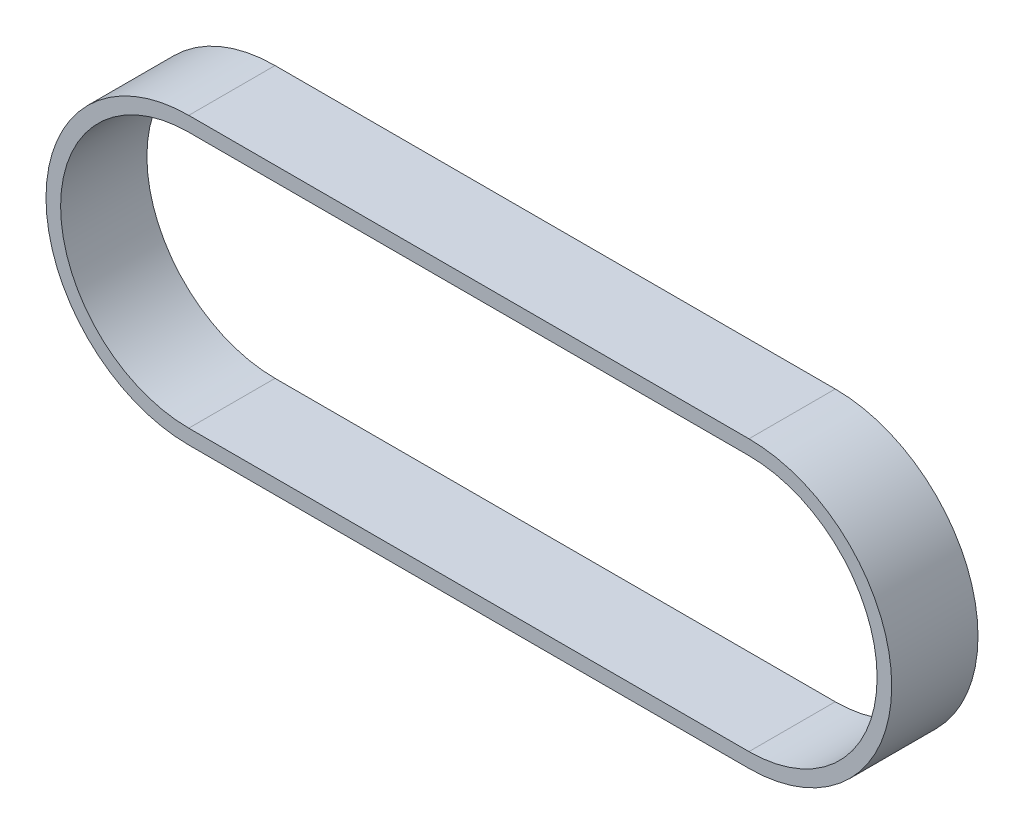
from build123d import *

# Parameters (mm, degrees)
BOSS_EXTRUDE1_DEPTH = 15


with BuildPart() as part:
    # Sketch1 → Boss-Extrude1 (new body)
    with BuildSketch(Plane.XY):
        with BuildLine():
            Line((0, 24.8158), (97.3836, 24.8158))
            ThreePointArc((97.3836, 24.8158), (122.1994, 0), (97.3836, -24.8158))
            Line((97.3836, -24.8158), (0, -24.8158))
            ThreePointArc((0, -24.8158), (-24.8158, 0), (0, 24.8158))
        make_face()
        with BuildLine():
            Line((0, 22.2758), (97.3836, 22.2758))
            ThreePointArc((97.3836, 22.2758), (119.6594, 0), (97.3836, -22.2758))
            Line((97.3836, -22.2758), (0, -22.2758))
            ThreePointArc((0, -22.2758), (-22.2758, 0), (0, 22.2758))
        make_face(mode=Mode.SUBTRACT)
    extrude(amount=BOSS_EXTRUDE1_DEPTH)


solid = part.part
